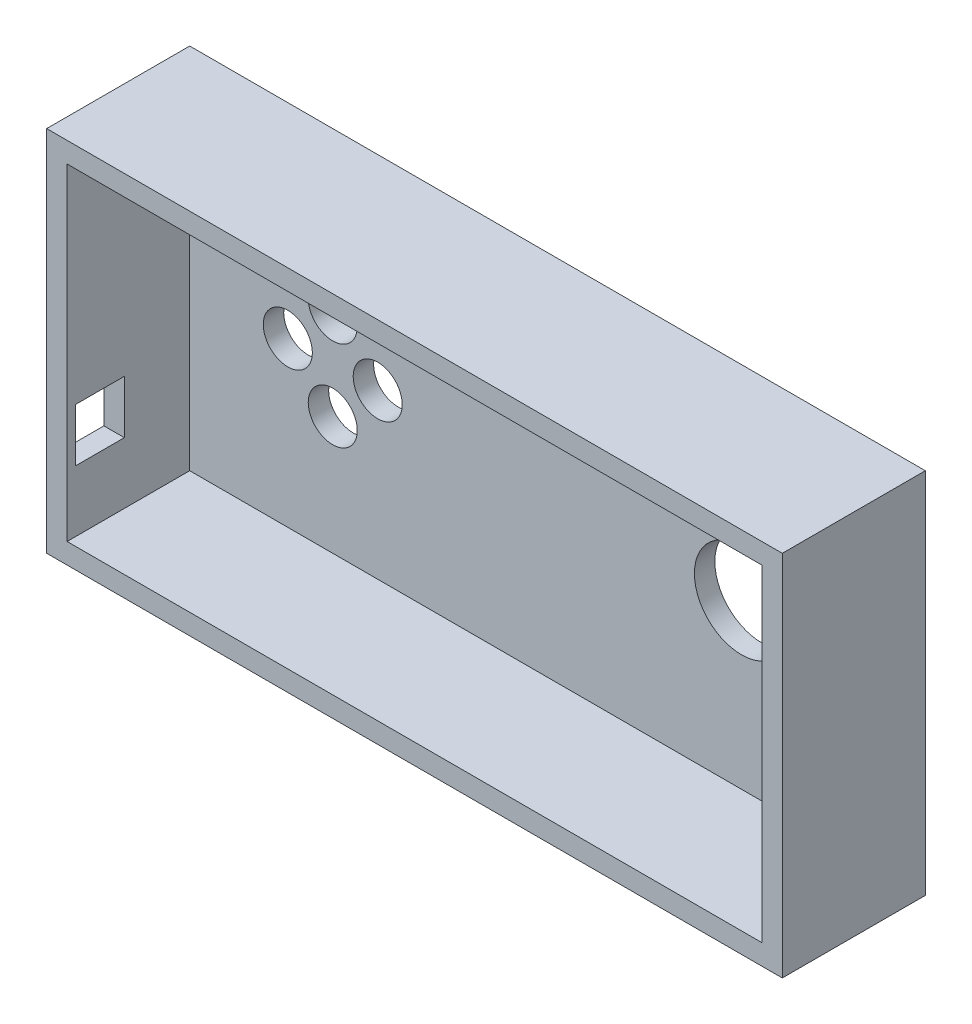
from build123d import *

# Parameters (mm, degrees)
ESQUISSE1_W             = 180
ESQUISSE1_H             = 90
BOSS_EXTRU_1_DEPTH      = 5
ESQUISSE2_W             = 180
ESQUISSE2_H             = 90
ESQUISSE2_W_2           = 170
ESQUISSE2_H_2           = 80
BOSS_EXTRU_2_DEPTH      = 30
ESQUISSE3_R             = 11.5
ESQUISSE3_R_2           = 6
ENL_V_MAT_EXTRU_1_DEPTH = 5
ESQUISSE4_W             = 12
ESQUISSE4_H             = 13
ENL_V_MAT_EXTRU_2_DEPTH = 5


with BuildPart() as part:
    # Esquisse1 → Boss.-Extru.1 (new body)
    with BuildSketch(Plane.XY):
        with Locations((90, 45)):
            Rectangle(ESQUISSE1_W, ESQUISSE1_H)
    extrude(amount=BOSS_EXTRU_1_DEPTH)

    # Esquisse2 → Boss.-Extru.2 (add)
    with BuildSketch(Plane.XY.offset(5)):
        with Locations((90, 45)):
            Rectangle(ESQUISSE2_W, ESQUISSE2_H)
        with Locations((90, 45)):
            Rectangle(ESQUISSE2_W_2, ESQUISSE2_H_2, mode=Mode.SUBTRACT)
    extrude(amount=BOSS_EXTRU_2_DEPTH)

    # Esquisse3 → Enlèv. mat.-Extru.1 (cut)
    with BuildSketch(Plane(origin=(0, 0, 0), x_dir=(-1, 0, 0), z_dir=(0, 0, -1))):
        with Locations((-140, 45)):
            Circle(ESQUISSE3_R)
        with Locations((-40, 56)):
            Circle(ESQUISSE3_R_2)
        with Locations((-40, 34)):
            Circle(ESQUISSE3_R_2)
        with Locations((-51, 45)):
            Circle(ESQUISSE3_R_2)
        with Locations((-29, 45)):
            Circle(ESQUISSE3_R_2)
    extrude(amount=-ENL_V_MAT_EXTRU_1_DEPTH, mode=Mode.SUBTRACT)

    # Esquisse4 → Enlèv. mat.-Extru.2 (cut)
    with BuildSketch(Plane.ZY):
        with Locations((27, 26.5)):
            Rectangle(ESQUISSE4_W, ESQUISSE4_H)
    extrude(amount=-ENL_V_MAT_EXTRU_2_DEPTH, mode=Mode.SUBTRACT)


solid = part.part
